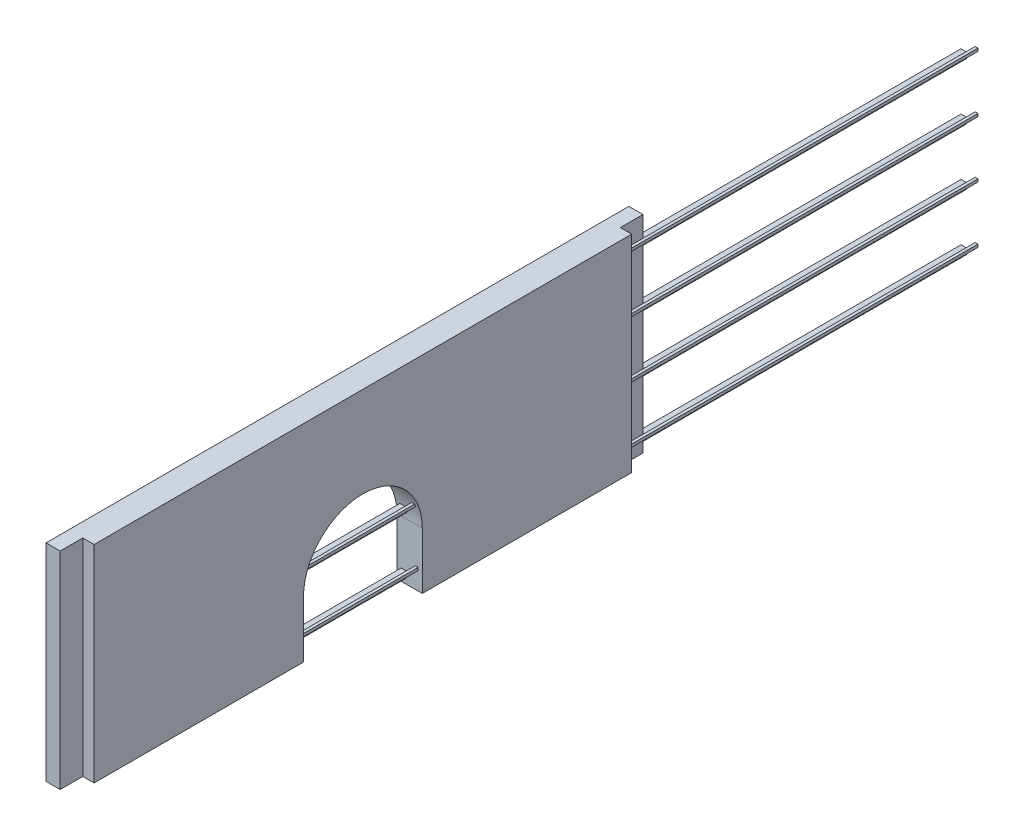
from build123d import *

# Parameters (mm, degrees)
SKETCH_1_W          = 2.5
SKETCH_1_H          = 103
SKETCH_1_W_2        = 2
SKETCH_1_H_2        = 95
EXTRUDE_1_DEPTH     = 99.5
CUT_EXTRUDE_2_DEPTH = 4.5
CUT_EXTRUDE_3_DEPTH = 58.5
CUT_EXTRUDE_4_DEPTH = 4.5
SKETCH_6_W          = 1.6
SKETCH_6_H          = 17
CUT_EXTRUDE_5_DEPTH = 10
EXTRUDE_START       = -62
SKETCH_7_W          = 1
SKETCH_7_H          = 1
EXTRUDE_2_DEPTH     = 119.954657
EXTRUDE_START_2     = -58
SKETCH_8_W          = 0.5
SKETCH_8_H          = 0.5
EXTRUDE_3_DEPTH     = 119.954657


with BuildPart() as part:
    # 스케치1 → 보스-돌출1 (new body)
    with BuildSketch(Plane(origin=(0, 0, 0), x_dir=(1, 0, 0), z_dir=(0, 1, 0))):
        with Locations((1.25, -51.5)):
            Rectangle(SKETCH_1_W, SKETCH_1_H)
        with Locations((3.5, -51.5)):
            Rectangle(SKETCH_1_W_2, SKETCH_1_H_2)
    extrude(amount=EXTRUDE_1_DEPTH)

    # 스케치2 → 컷-돌출2 (cut)
    with BuildSketch(Plane(origin=(4.5, 0, 0), x_dir=(0, 0, -1), z_dir=(1, 0, 0))):
        with BuildLine():
            Line((-62, 10), (-62, 0))
            Line((-62, 0), (-41, 0))
            Line((-41, 0), (-41, 10))
            ThreePointArc((-41, 10), (-51.5, 20.5), (-62, 10))
        make_face()
    extrude(amount=-CUT_EXTRUDE_2_DEPTH, mode=Mode.SUBTRACT)

    # 스케치3 → 컷-돌출3 (cut)
    with BuildSketch(Plane(origin=(0, 99.5, 0), x_dir=(1, 0, 0), z_dir=(0, 1, 0))):
        Polygon((2.5, -4), (2.5, 0), (0, 0), (0, -103), (2.5, -103), (2.5, -99), (4.5, -99), (4.5, -4), align=None)
    extrude(amount=-CUT_EXTRUDE_3_DEPTH, mode=Mode.SUBTRACT)

    # 스케치4 → 컷-돌출4 (cut)
    with BuildSketch(Plane(origin=(0, 41, 0), x_dir=(1, 0, 0), z_dir=(0, 1, 0))):
        Polygon((4.5, -4), (2.5, -4), (2.5, 0), (0, 0), (0, -103), (2.5, -103), (2.5, -99), (4.5, -99), align=None)
    extrude(amount=-CUT_EXTRUDE_4_DEPTH, mode=Mode.SUBTRACT)

    # 스케치6 → 컷-돌출5 (cut)
    with BuildSketch(Plane.XZ):
        with Locations((0.8, 74)):
            Rectangle(SKETCH_6_W, SKETCH_6_H)
    extrude(amount=-CUT_EXTRUDE_5_DEPTH, mode=Mode.SUBTRACT)

    # 스케치7 → 보스-돌출2 (add)
    with BuildSketch(Plane(origin=(0, 0, 0), x_dir=(-1, 0, 0), z_dir=(0, 0, -1)).offset(EXTRUDE_START)):
        with Locations((-1.25, 1.524584525)):
            Rectangle(SKETCH_7_W, SKETCH_7_H)
        with Locations((-1.25, 11.524584525)):
            Rectangle(SKETCH_7_W, SKETCH_7_H)
        with Locations((-1.25, 21.524584525)):
            Rectangle(SKETCH_7_W, SKETCH_7_H)
        with Locations((-1.25, 31.524584525)):
            Rectangle(SKETCH_7_W, SKETCH_7_H)
    extrude(amount=EXTRUDE_2_DEPTH)

    # 스케치8 → 보스-돌출3 (add)
    with BuildSketch(Plane(origin=(0, 0, 4), x_dir=(-1, 0, 0), z_dir=(0, 0, -1)).offset(EXTRUDE_START_2)):
        with Locations((-3.5, 3.368615417)):
            Rectangle(SKETCH_8_W, SKETCH_8_H)
        with Locations((-3.5, 13.368615417)):
            Rectangle(SKETCH_8_W, SKETCH_8_H)
        with Locations((-3.5, 23.368615417)):
            Rectangle(SKETCH_8_W, SKETCH_8_H)
        with Locations((-3.5, 33.368615417)):
            Rectangle(SKETCH_8_W, SKETCH_8_H)
    extrude(amount=EXTRUDE_3_DEPTH)


solid = part.part
